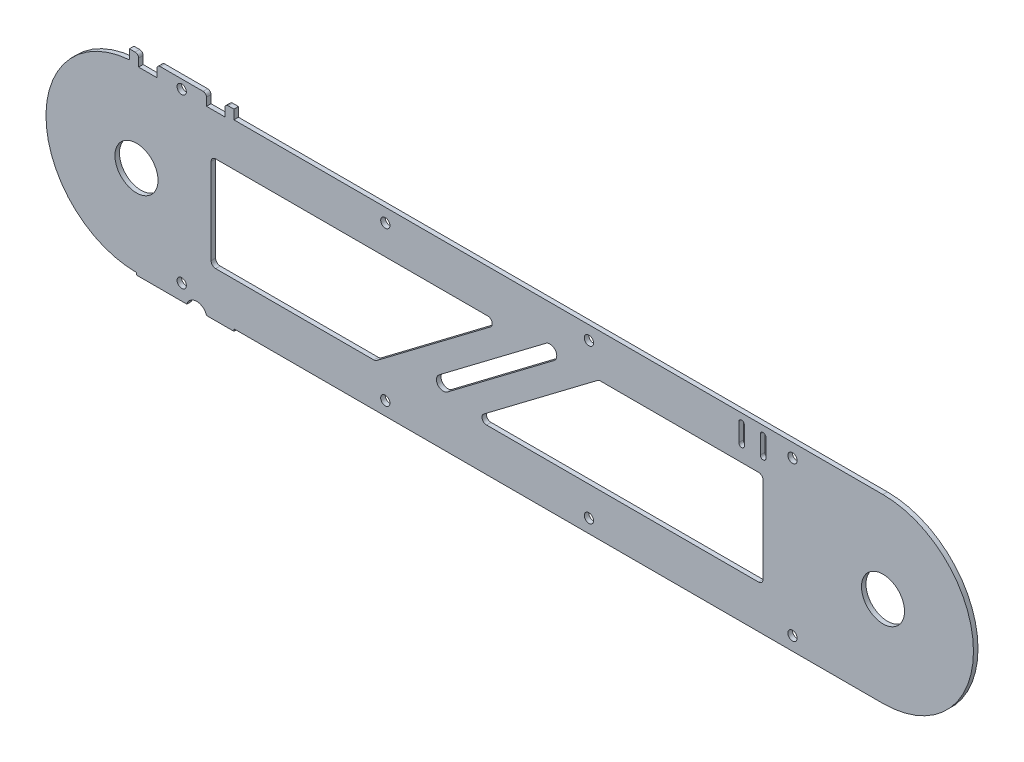
from build123d import *

# Parameters (mm, degrees)
SKETCH_1_R          = 9.52
EXTRUDE_1_DEPTH     = 2
SKETCH_4_W          = 43.1
SKETCH_4_H          = 0.98
SKETCH_4_W_2        = 46.2
SKETCH_4_H_2        = 8.602857229
EXTRUDE_2_DEPTH     = 2
SKETCH_2_R          = 2.05
CUT_EXTRUDE_1_DEPTH = 4
CUT_EXTRUDE_2_DEPTH = 10
FILLET_1_R          = 2
CUT_EXTRUDE_3_DEPTH = 2
FILLET_2_R          = 1.5


with BuildPart() as part:
    # 草图1 → 凸台-拉伸1 (new body)
    with BuildSketch(Plane.XY):
        with BuildLine():
            Line((328.542857143, -40.145714286), (-1.457142857, -40.145714286))
            ThreePointArc((-1.457142857, -40.145714286), (-41.457142857, -0.145714286), (-1.457142857, 39.854285714))
            Line((-1.457142857, 39.854285714), (328.542857143, 39.854285714))
            ThreePointArc((328.542857143, 39.854285714), (368.542857143, -0.145714286), (328.542857143, -40.145714286))
        make_face()
        with Locations((-1.457142857, -0.145714286)):
            Circle(SKETCH_1_R, mode=Mode.SUBTRACT)
        with Locations((328.542857143, -0.145714286)):
            Circle(SKETCH_1_R, mode=Mode.SUBTRACT)
        with BuildLine():
            Line((276.792857143, 35.854285714), (276.792857143, 27.854285714))
            ThreePointArc((276.792857143, 27.854285714), (275.542857143, 26.604285714), (274.292857143, 27.854285714))
            Line((274.292857143, 27.854285714), (274.292857143, 35.854285714))
            ThreePointArc((274.292857143, 35.854285714), (275.542857143, 37.104285714), (276.792857143, 35.854285714))
        make_face(mode=Mode.SUBTRACT)
        with BuildLine():
            Line((264.792857143, 27.854285714), (264.792857143, 35.854285714))
            ThreePointArc((264.792857143, 35.854285714), (266.042857143, 37.104285714), (267.292857143, 35.854285714))
            Line((267.292857143, 35.854285714), (267.292857143, 27.854285714))
            ThreePointArc((267.292857143, 27.854285714), (266.042857143, 26.604285714), (264.792857143, 27.854285714))
        make_face(mode=Mode.SUBTRACT)
    extrude(amount=EXTRUDE_1_DEPTH)

    # 草图4 → 凸台-拉伸2 (add)
    with BuildSketch(Plane.XY.offset(2)):
        with Locations((20.092857143, -40.635714286)):
            Rectangle(SKETCH_4_W, SKETCH_4_H)
        with Locations((18.542857143, 39.652857099)):
            Rectangle(SKETCH_4_W_2, SKETCH_4_H_2)
    extrude(amount=-EXTRUDE_2_DEPTH)

    # 草图2 → 切除-拉伸1 (cut)
    with BuildSketch(Plane.XY.offset(2)):
        with Locations((108.542857143, 33.854285714)):
            Circle(SKETCH_2_R)
        with Locations((198.542857143, 33.854285714)):
            Circle(SKETCH_2_R)
        with Locations((288.542857143, 33.854285714)):
            Circle(SKETCH_2_R)
        with Locations((108.542857143, -34.145714286)):
            Circle(SKETCH_2_R)
        with Locations((198.542857143, -34.145714286)):
            Circle(SKETCH_2_R)
        with Locations((288.542857143, -34.145714286)):
            Circle(SKETCH_2_R)
        with Locations((18.542857143, -34.145714286)):
            Circle(SKETCH_2_R)
        with Locations((18.542857143, 40.014285714)):
            Circle(SKETCH_2_R)
        Polygon((31.542857143, -21.145714286), (104.183898028, -21.145714286), (159.772133322, 20.854285714), (31.542857143, 20.854285714), align=None)
        Polygon((275.542857143, 20.854285714), (202.901816258, 20.854285714), (147.313580964, -21.145714286), (275.542857143, -21.145714286), align=None)
        Polygon((29.492857143, 41.064285714), (29.492857143, 38.964285714), (37.592857143, 38.964285714), (37.592857143, 41.064285714), (37.592857143, 53.579710622), (29.492857143, 53.579710622), align=None)
        Polygon((-0.507142857, 41.064285714), (-0.507142857, 38.964285714), (7.592857143, 38.964285714), (7.592857143, 41.064285714), (7.592857143, 53.579710622), (-0.507142857, 53.579710622), align=None)
    extrude(amount=-CUT_EXTRUDE_1_DEPTH, mode=Mode.SUBTRACT)

    # 草图3 → 切除-拉伸2 (cut)
    with BuildSketch(Plane.XY.offset(2)):
        with BuildLine():
            Line((183.145474057, 18.460683743), (135.97586329, -17.178577727))
            ThreePointArc((135.97586329, -17.178577727), (131.77376205, -16.593475022), (132.358864754, -12.391373783))
            Line((132.358864754, -12.391373783), (179.528475522, 23.247887686))
            ThreePointArc((179.528475522, 23.247887686), (183.730576762, 22.662784982), (183.145474057, 18.460683743))
        make_face()
    extrude(amount=-CUT_EXTRUDE_2_DEPTH, mode=Mode.SUBTRACT)

    # 圆角1
    fillet_1_edges = [part.edges().sort_by_distance(p)[0] for p in [
        (275.542857143, 20.854285714, 1),
        (275.542857143, -21.145714286, 1),
        (147.313580964, -21.145714286, 1),
        (202.901816258, 20.854285714, 1),
        (31.542857143, -21.145714286, 1),
        (31.542857143, 20.854285714, 1),
        (159.772133322, 20.854285714, 1),
        (104.183898028, -21.145714286, 1),
    ]]
    fillet(fillet_1_edges, radius=FILLET_1_R)

    # 草图5 → 切除-拉伸3 (cut)
    with BuildSketch(Plane.XY.offset(2)):
        with BuildLine():
            Line((20.806207352, -41.125714286), (29.507867411, -41.125714286))
            ThreePointArc((29.507867411, -41.125714286), (25.157037382, -37.88123609), (20.806207352, -41.125714286))
        make_face()
    extrude(amount=-CUT_EXTRUDE_3_DEPTH, mode=Mode.SUBTRACT)

    # 圆角2
    fillet_2_edges = [part.edges().sort_by_distance(p)[0] for p in [
        (37.592857143, 43.954285714, 1),
        (29.492857143, 43.954285714, 1),
        (-0.507142857, 43.954285714, 1),
        (7.592857143, 43.954285714, 1),
    ]]
    fillet(fillet_2_edges, radius=FILLET_2_R)


solid = part.part
